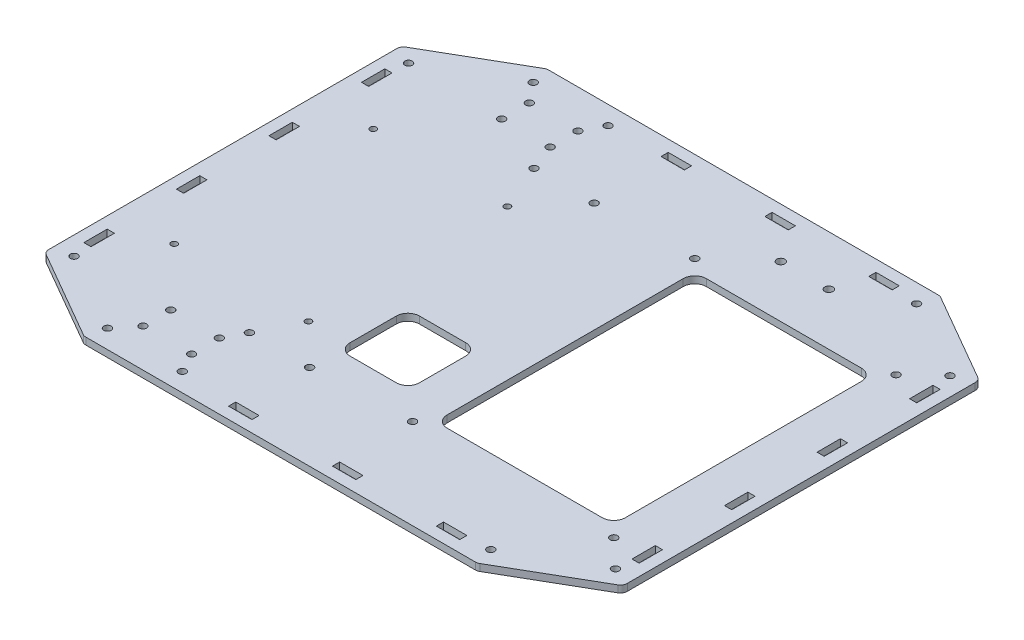
from build123d import *

# Parameters (mm, degrees)
SKETCH1_R           = 1.6
SKETCH1_R_2         = 1.59
SKETCH1_R_3         = 1.75
SKETCH1_W           = 10.1
SKETCH1_H           = 3.1
SKETCH1_W_2         = 3.1
SKETCH1_H_2         = 10.1
BOSS_EXTRUDE1_DEPTH = 3
CUT_EXTRUDE1_REACH  = 162.106
SKETCH3_R           = 1.35
SKETCH3_R_2         = 1.6
FILLET1_R           = 3


with BuildPart() as part:
    # Sketch1 → Boss-Extrude1 (new body)
    with BuildSketch(Plane(origin=(0, 0, 0), x_dir=(1, 0, 0), z_dir=(0, 1, 0))):
        Polygon((-85, 100), (85, 100), (125, 76.905989232), (125, -76.905989232), (85, -100), (-85, -100), (-125, -76.905989232), (-125, 76.905989232), align=None)
        with Locations(Location((-50.5, -63, 0), (0, 0, 270))):
            Circle(SKETCH1_R, mode=Mode.SUBTRACT)
        with Locations(Location((82.856406461, 92, 0), (0, 0, 270))):
            Circle(SKETCH1_R, mode=Mode.SUBTRACT)
        with Locations(Location((117, 72.287187079, 0), (0, 0, 270))):
            Circle(SKETCH1_R, mode=Mode.SUBTRACT)
        with Locations(Location((117, -72.287187079, 0), (0, 0, 270))):
            Circle(SKETCH1_R, mode=Mode.SUBTRACT)
        with Locations(Location((82.856406461, -92, 0), (0, 0, 270))):
            Circle(SKETCH1_R, mode=Mode.SUBTRACT)
        with Locations(Location((-24.5, -63, 0), (0, 0, 270))):
            Circle(SKETCH1_R, mode=Mode.SUBTRACT)
        with Locations(Location((-24.5, 60, 0), (0, 0, 270))):
            Circle(SKETCH1_R, mode=Mode.SUBTRACT)
        with Locations(Location((-117, -72.287187079, 0), (0, 0, 270))):
            Circle(SKETCH1_R, mode=Mode.SUBTRACT)
        with Locations(Location((-50.5, -92, 0), (0, 0, 270))):
            Circle(SKETCH1_R, mode=Mode.SUBTRACT)
        with Locations(Location((-50.5, 60, 0), (0, 0, 270))):
            Circle(SKETCH1_R, mode=Mode.SUBTRACT)
        with Locations(Location((-117, 72.287187079, 0), (0, 0, 270))):
            Circle(SKETCH1_R, mode=Mode.SUBTRACT)
        with Locations(Location((-50.5, 92, 0), (0, 0, 270))):
            Circle(SKETCH1_R, mode=Mode.SUBTRACT)
        with Locations(Location((-82.856406461, -92, 0), (0, 0, 270))):
            Circle(SKETCH1_R, mode=Mode.SUBTRACT)
        with Locations(Location((-82.856406461, 92, 0), (0, 0, 270))):
            Circle(SKETCH1_R, mode=Mode.SUBTRACT)
        with Locations(Location((-55, 71.5, 0), (0, 0, 270))):
            Circle(SKETCH1_R_2, mode=Mode.SUBTRACT)
        with Locations(Location((-76, 71.5, 0), (0, 0, 270))):
            Circle(SKETCH1_R_2, mode=Mode.SUBTRACT)
        with Locations(Location((-55, 83.5, 0), (0, 0, 90))):
            Circle(SKETCH1_R_2, mode=Mode.SUBTRACT)
        with Locations(Location((-76, 83.5, 0), (0, 0, 90))):
            Circle(SKETCH1_R_2, mode=Mode.SUBTRACT)
        with Locations(Location((-55, -83.5, 0), (0, 0, 270))):
            Circle(SKETCH1_R_2, mode=Mode.SUBTRACT)
        with Locations(Location((-55, -71.5, 0), (0, 0, 90))):
            Circle(SKETCH1_R_2, mode=Mode.SUBTRACT)
        with Locations(Location((-76, -71.5, 0), (0, 0, 90))):
            Circle(SKETCH1_R_2, mode=Mode.SUBTRACT)
        with Locations(Location((-76, -83.5, 0), (0, 0, 270))):
            Circle(SKETCH1_R_2, mode=Mode.SUBTRACT)
        with Locations(Location((37.707416379, 78.475, 0), (0, 0, 270))):
            Circle(SKETCH1_R_3, mode=Mode.SUBTRACT)
        with Locations(Location((58.457416379, 78.475, 0), (0, 0, 270))):
            Circle(SKETCH1_R_3, mode=Mode.SUBTRACT)
        with Locations((-22.45, -93.45)):
            Rectangle(SKETCH1_W, SKETCH1_H, mode=Mode.SUBTRACT)
        with Locations((-118.45, 60)):
            Rectangle(SKETCH1_W_2, SKETCH1_H_2, mode=Mode.SUBTRACT)
        with Locations((-118.45, 20)):
            Rectangle(SKETCH1_W_2, SKETCH1_H_2, mode=Mode.SUBTRACT)
        with Locations((-118.45, -20)):
            Rectangle(SKETCH1_W_2, SKETCH1_H_2, mode=Mode.SUBTRACT)
        with Locations((-118.45, -60)):
            Rectangle(SKETCH1_W_2, SKETCH1_H_2, mode=Mode.SUBTRACT)
        with Locations((118.45, -60)):
            Rectangle(SKETCH1_W_2, SKETCH1_H_2, mode=Mode.SUBTRACT)
        with Locations((118.45, -20)):
            Rectangle(SKETCH1_W_2, SKETCH1_H_2, mode=Mode.SUBTRACT)
        with Locations((118.45, 20)):
            Rectangle(SKETCH1_W_2, SKETCH1_H_2, mode=Mode.SUBTRACT)
        with Locations((118.45, 60)):
            Rectangle(SKETCH1_W_2, SKETCH1_H_2, mode=Mode.SUBTRACT)
        with Locations((22.45, -93.45)):
            Rectangle(SKETCH1_W, SKETCH1_H, mode=Mode.SUBTRACT)
        with Locations((67.35, -93.45)):
            Rectangle(SKETCH1_W, SKETCH1_H, mode=Mode.SUBTRACT)
        with Locations((67.35, 93.45)):
            Rectangle(SKETCH1_W, SKETCH1_H, mode=Mode.SUBTRACT)
        with Locations((22.45, 93.45)):
            Rectangle(SKETCH1_W, SKETCH1_H, mode=Mode.SUBTRACT)
        with Locations((-22.45, 93.45)):
            Rectangle(SKETCH1_W, SKETCH1_H, mode=Mode.SUBTRACT)
    extrude(amount=BOSS_EXTRUDE1_DEPTH)

    # Sketch3 → Cut-Extrude1 (cut, up to next)
    with BuildSketch(Plane(origin=(0, 3, 0), x_dir=(1, 0, 0), z_dir=(0, 1, 0)), mode=Mode.PRIVATE) as cut_extrude1_sk1:
        with Locations(Location((-100, -46, 0), (0, 0, 270))):
            Circle(SKETCH3_R)
    cut_extrude1_tool1 = extrude(cut_extrude1_sk1.sketch, amount=-CUT_EXTRUDE1_REACH, mode=Mode.PRIVATE) & part.part
    # Sketch3 → Cut-Extrude1 (cut, up to next)
    with BuildSketch(Plane(origin=(0, 3, 0), x_dir=(1, 0, 0), z_dir=(0, 1, 0)), mode=Mode.PRIVATE) as cut_extrude1_sk2:
        with Locations(Location((-42, -46, 0), (0, 0, 270))):
            Circle(SKETCH3_R)
    cut_extrude1_tool2 = extrude(cut_extrude1_sk2.sketch, amount=-CUT_EXTRUDE1_REACH, mode=Mode.PRIVATE) & part.part
    # Sketch3 → Cut-Extrude1 (cut, up to next)
    with BuildSketch(Plane(origin=(0, 3, 0), x_dir=(1, 0, 0), z_dir=(0, 1, 0)), mode=Mode.PRIVATE) as cut_extrude1_sk3:
        with Locations(Location((-42, 40, 0), (0, 0, 270))):
            Circle(SKETCH3_R)
    cut_extrude1_tool3 = extrude(cut_extrude1_sk3.sketch, amount=-CUT_EXTRUDE1_REACH, mode=Mode.PRIVATE) & part.part
    # Sketch3 → Cut-Extrude1 (cut, up to next)
    with BuildSketch(Plane(origin=(0, 3, 0), x_dir=(1, 0, 0), z_dir=(0, 1, 0)), mode=Mode.PRIVATE) as cut_extrude1_sk4:
        with Locations(Location((-100, 40, 0), (0, 0, 270))):
            Circle(SKETCH3_R)
    cut_extrude1_tool4 = extrude(cut_extrude1_sk4.sketch, amount=-CUT_EXTRUDE1_REACH, mode=Mode.PRIVATE) & part.part
    # Sketch3 → Cut-Extrude1 (cut, up to next)
    with BuildSketch(Plane(origin=(0, 3, 0), x_dir=(1, 0, 0), z_dir=(0, 1, 0)), mode=Mode.PRIVATE) as cut_extrude1_sk5:
        with Locations(Location((18, 61, 0), (0, 0, 270))):
            Circle(SKETCH3_R_2)
    cut_extrude1_tool5 = extrude(cut_extrude1_sk5.sketch, amount=-CUT_EXTRUDE1_REACH, mode=Mode.PRIVATE) & part.part
    # Sketch3 → Cut-Extrude1 (cut, up to next)
    with BuildSketch(Plane(origin=(0, 3, 0), x_dir=(1, 0, 0), z_dir=(0, 1, 0)), mode=Mode.PRIVATE) as cut_extrude1_sk6:
        with Locations(Location((105, 61, 0), (0, 0, 270))):
            Circle(SKETCH3_R_2)
    cut_extrude1_tool6 = extrude(cut_extrude1_sk6.sketch, amount=-CUT_EXTRUDE1_REACH, mode=Mode.PRIVATE) & part.part
    # Sketch3 → Cut-Extrude1 (cut, up to next)
    with BuildSketch(Plane(origin=(0, 3, 0), x_dir=(1, 0, 0), z_dir=(0, 1, 0)), mode=Mode.PRIVATE) as cut_extrude1_sk7:
        with Locations(Location((105, -61, 0), (0, 0, 270))):
            Circle(SKETCH3_R_2)
    cut_extrude1_tool7 = extrude(cut_extrude1_sk7.sketch, amount=-CUT_EXTRUDE1_REACH, mode=Mode.PRIVATE) & part.part
    # Sketch3 → Cut-Extrude1 (cut, up to next)
    with BuildSketch(Plane(origin=(0, 3, 0), x_dir=(1, 0, 0), z_dir=(0, 1, 0)), mode=Mode.PRIVATE) as cut_extrude1_sk8:
        with Locations(Location((18, -61, 0), (0, 0, 270))):
            Circle(SKETCH3_R_2)
    cut_extrude1_tool8 = extrude(cut_extrude1_sk8.sketch, amount=-CUT_EXTRUDE1_REACH, mode=Mode.PRIVATE) & part.part
    # Sketch3 → Cut-Extrude1 (cut, up to next)
    with BuildSketch(Plane(origin=(0, 3, 0), x_dir=(1, 0, 0), z_dir=(0, 1, 0)), mode=Mode.PRIVATE) as cut_extrude1_sk9:
        with BuildLine():
            Line((28, 56), (95, 56))
            ThreePointArc((95, 56), (98.535533906, 54.535533906), (100, 51))
            Line((100, 51), (100, -51))
            ThreePointArc((100, -51), (98.535533906, -54.535533906), (95, -56))
            Line((95, -56), (28, -56))
            ThreePointArc((28, -56), (24.464466094, -54.535533906), (23, -51))
            Line((23, -51), (23, 51))
            ThreePointArc((23, 51), (24.464466094, 54.535533906), (28, 56))
        make_face()
    cut_extrude1_tool9 = extrude(cut_extrude1_sk9.sketch, amount=-CUT_EXTRUDE1_REACH, mode=Mode.PRIVATE) & part.part
    # Sketch3 → Cut-Extrude1 (cut, up to next)
    with BuildSketch(Plane(origin=(0, 3, 0), x_dir=(1, 0, 0), z_dir=(0, 1, 0)), mode=Mode.PRIVATE) as cut_extrude1_sk10:
        with BuildLine():
            Line((-20, -50), (0, -50))
            ThreePointArc((0, -50), (3.535533906, -48.535533906), (5, -45))
            Line((5, -45), (5, -25))
            ThreePointArc((5, -25), (3.535533906, -21.464466094), (0, -20))
            Line((0, -20), (-20, -20))
            ThreePointArc((-20, -20), (-23.535533906, -21.464466094), (-25, -25))
            Line((-25, -25), (-25, -45))
            ThreePointArc((-25, -45), (-23.535533906, -48.535533906), (-20, -50))
        make_face()
    cut_extrude1_tool10 = extrude(cut_extrude1_sk10.sketch, amount=-CUT_EXTRUDE1_REACH, mode=Mode.PRIVATE) & part.part
    add(cut_extrude1_tool1.solids().sort_by_distance((-100, 3, 46))[0], mode=Mode.SUBTRACT)
    add(cut_extrude1_tool2.solids().sort_by_distance((-42, 3, 46))[0], mode=Mode.SUBTRACT)
    add(cut_extrude1_tool3.solids().sort_by_distance((-42, 3, -40))[0], mode=Mode.SUBTRACT)
    add(cut_extrude1_tool4.solids().sort_by_distance((-100, 3, -40))[0], mode=Mode.SUBTRACT)
    add(cut_extrude1_tool5.solids().sort_by_distance((18, 3, -61))[0], mode=Mode.SUBTRACT)
    add(cut_extrude1_tool6.solids().sort_by_distance((105, 3, -61))[0], mode=Mode.SUBTRACT)
    add(cut_extrude1_tool7.solids().sort_by_distance((105, 3, 61))[0], mode=Mode.SUBTRACT)
    add(cut_extrude1_tool8.solids().sort_by_distance((18, 3, 61))[0], mode=Mode.SUBTRACT)
    add(cut_extrude1_tool9.solids().sort_by_distance((61.5, 3, 0))[0], mode=Mode.SUBTRACT)
    add(cut_extrude1_tool10.solids().sort_by_distance((-10, 3, 35))[0], mode=Mode.SUBTRACT)

    # Fillet1
    fillet1_edges = [part.edges().sort_by_distance(p)[0] for p in [
        (-85, 1.5, -100),
        (85, 1.5, -100),
        (125, 1.5, -76.905989232),
        (125, 1.5, 76.905989232),
        (85, 1.5, 100),
        (-85, 1.5, 100),
        (-125, 1.5, 76.905989232),
        (-125, 1.5, -76.905989232),
    ]]
    fillet(fillet1_edges, radius=FILLET1_R)


solid = part.part
